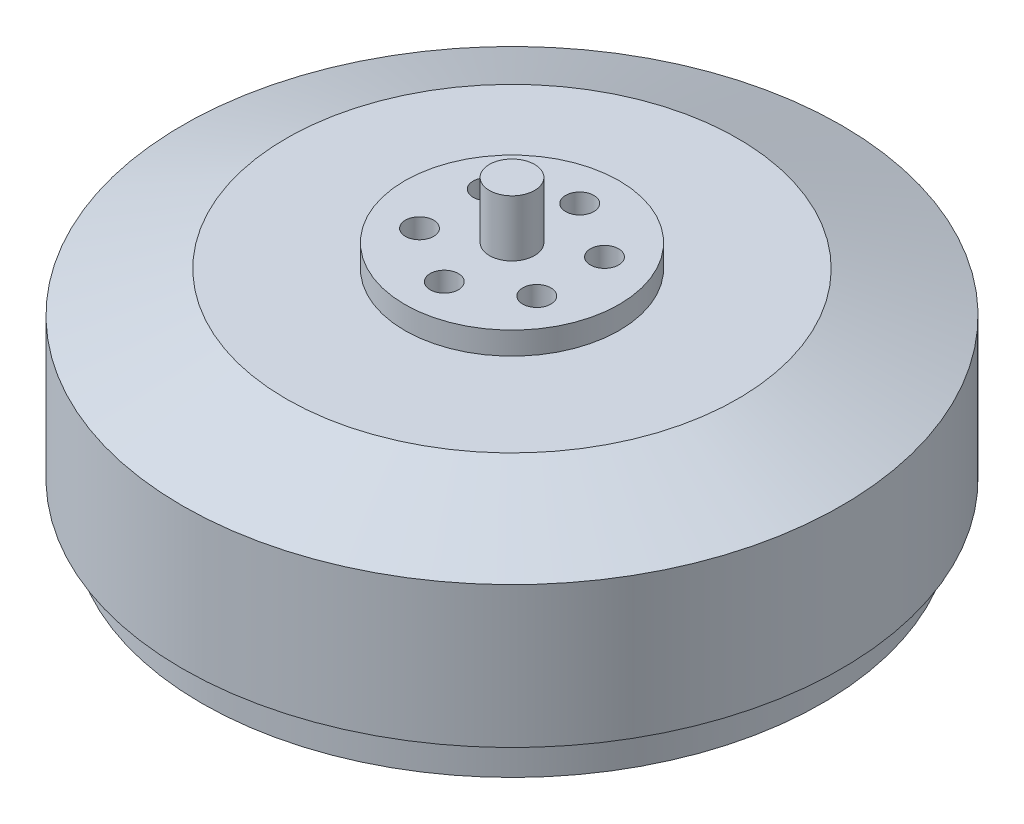
from build123d import *

# Parameters (mm, degrees)
BOSS_EXTRUDE1_REACH       = 53.998
SKETCH2_R                 = 5
FILLET1_R                 = 2
M3X0_5_TAPPED_HOLE1_D     = 2.5
M3X0_5_TAPPED_HOLE1_DEPTH = 4
M3X0_5_TAPPED_HOLE1_TIP   = 0.751075774
M3X0_5_TAPPED_HOLE2_D     = 2.5
M3X0_5_TAPPED_HOLE2_DEPTH = 4
M3X0_5_TAPPED_HOLE2_TIP   = 0.751075774


with BuildPart() as part:
    # Sketch1 → Revolve1 (revolve)
    with BuildSketch(Plane.XY, mode=Mode.PRIVATE) as revolve1_sk:
        Polygon((0, 15.8), (0, -15.8), (-12.5, -15.8), (-12.5, -10.8), (-27.5, -10.8), (-27.5, -7.3), (-29.2, -7.3), (-29.2, 5.2), (-20, 8.8), (-9.5, 8.8), (-9.5, 10.8), (-2, 10.8), (-2, 15.8), align=None)
    revolve(revolve1_sk.sketch.rotate(Axis((0, 0, 0), (0, -1, 0)), 270), axis=Axis((0, 0, 0), (0, -1, 0)))

    # Sketch2 → Boss-Extrude1 (add, up to next)
    with BuildSketch(Plane.XZ.offset(15.8), mode=Mode.PRIVATE) as boss_extrude1_sk1:
        with Locations((0, 12.5)):
            Circle(SKETCH2_R)
    boss_extrude1_tool1 = extrude(boss_extrude1_sk1.sketch, amount=-BOSS_EXTRUDE1_REACH, mode=Mode.PRIVATE) - part.part
    # Sketch2 → Boss-Extrude1 (add, up to next)
    with BuildSketch(Plane.XZ.offset(15.8), mode=Mode.PRIVATE) as boss_extrude1_sk2:
        with Locations((12.5, 0)):
            Circle(SKETCH2_R)
    boss_extrude1_tool2 = extrude(boss_extrude1_sk2.sketch, amount=-BOSS_EXTRUDE1_REACH, mode=Mode.PRIVATE) - part.part
    # Sketch2 → Boss-Extrude1 (add, up to next)
    with BuildSketch(Plane.XZ.offset(15.8), mode=Mode.PRIVATE) as boss_extrude1_sk3:
        with Locations((0, -12.5)):
            Circle(SKETCH2_R)
    boss_extrude1_tool3 = extrude(boss_extrude1_sk3.sketch, amount=-BOSS_EXTRUDE1_REACH, mode=Mode.PRIVATE) - part.part
    # Sketch2 → Boss-Extrude1 (add, up to next)
    with BuildSketch(Plane.XZ.offset(15.8), mode=Mode.PRIVATE) as boss_extrude1_sk4:
        with Locations((-12.5, 0)):
            Circle(SKETCH2_R)
    boss_extrude1_tool4 = extrude(boss_extrude1_sk4.sketch, amount=-BOSS_EXTRUDE1_REACH, mode=Mode.PRIVATE) - part.part
    add(boss_extrude1_tool1.solids().sort_by_distance((0, -15.8, 12.5))[0])
    add(boss_extrude1_tool2.solids().sort_by_distance((12.5, -15.8, 0))[0])
    add(boss_extrude1_tool3.solids().sort_by_distance((0, -15.8, -12.5))[0])
    add(boss_extrude1_tool4.solids().sort_by_distance((-12.5, -15.8, 0))[0])

    # Fillet1
    fillet1_edges = [part.edges().sort_by_distance(p)[0] for p in [
        (4.898979486, -13.3, 11.5),
        (-4.898979486, -13.3, 11.5),
        (11.5, -13.3, -4.898979486),
        (11.5, -13.3, 4.898979486),
        (-4.898979486, -13.3, -11.5),
        (4.898979486, -13.3, -11.5),
        (-11.5, -13.3, 4.898979486),
        (-11.5, -13.3, -4.898979486),
    ]]
    fillet(fillet1_edges, radius=FILLET1_R)

    # M3x0.5 Tapped Hole1
    with Locations(Plane(origin=(0, -15.8, 0), x_dir=(-1, 0, 0), z_dir=(0, -1, 0))):
        with Locations((0, -12.5), (-12.5, 0), (0, 12.5), (12.5, 0)):
            Hole(M3X0_5_TAPPED_HOLE1_D / 2, depth=M3X0_5_TAPPED_HOLE1_DEPTH)
            with Locations((0, 0, -(M3X0_5_TAPPED_HOLE1_DEPTH + M3X0_5_TAPPED_HOLE1_TIP / 2))):  # 118° drill point
                Cone(0, M3X0_5_TAPPED_HOLE1_D / 2, M3X0_5_TAPPED_HOLE1_TIP, mode=Mode.SUBTRACT)

    # Sketch5 → Revolve2 (revolve)
    with BuildSketch(Plane.XY, mode=Mode.PRIVATE) as revolve2_sk:
        Polygon((0, -15.8), (-3.4, -15.8), (-3.4, -17.3), (-5.25, -17.3), (-5.25, -18.3), (-3.4, -18.3), (-3.4, -19.3), (0, -19.3), align=None)
    revolve(revolve2_sk.sketch.rotate(Axis((0, 0, 0), (0, -1, 0)), 270), axis=Axis((0, 0, 0), (0, -1, 0)))

    # M3x0.5 Tapped Hole2
    with Locations(Plane(origin=(0, 10.8, 0), x_dir=(1, 0, 0), z_dir=(0, 1, 0))):
        with Locations((0, 6), (5.196152423, 3), (5.196152423, -3), (0, -6), (-5.196152423, -3), (-5.196152423, 3)):
            Hole(M3X0_5_TAPPED_HOLE2_D / 2, depth=M3X0_5_TAPPED_HOLE2_DEPTH)
            with Locations((0, 0, -(M3X0_5_TAPPED_HOLE2_DEPTH + M3X0_5_TAPPED_HOLE2_TIP / 2))):  # 118° drill point
                Cone(0, M3X0_5_TAPPED_HOLE2_D / 2, M3X0_5_TAPPED_HOLE2_TIP, mode=Mode.SUBTRACT)


solid = part.part
